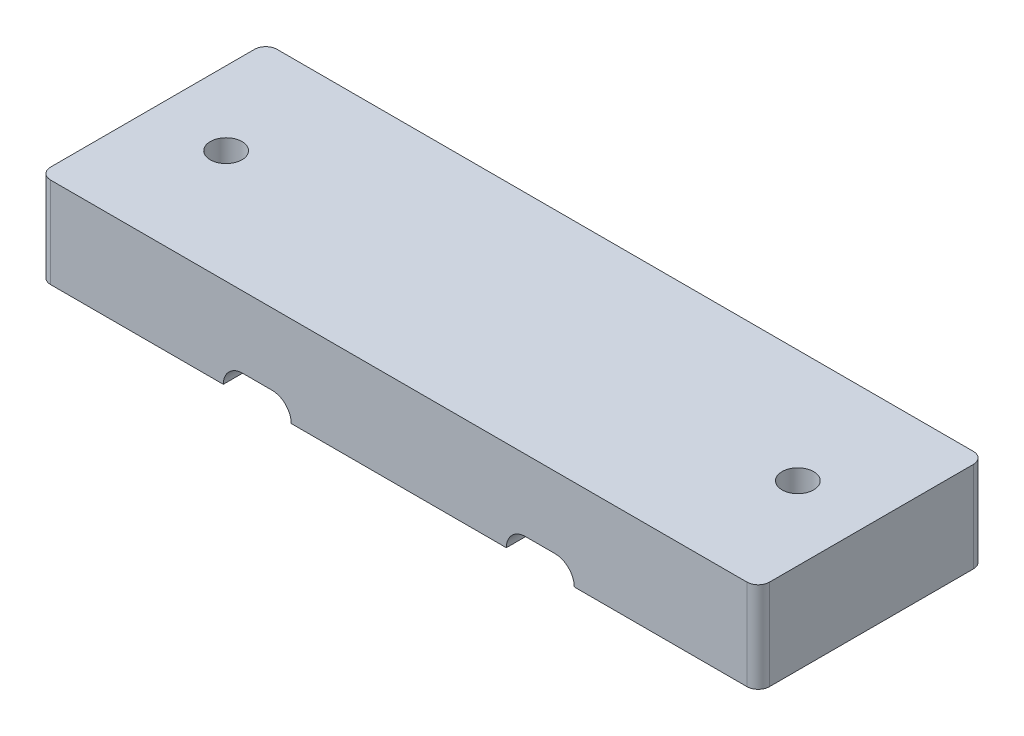
from build123d import *

# Parameters (mm, degrees)
SKETCH1_W            = 63.5
SKETCH1_H            = 20
SKETCH1_R            = 1.4
BASE_DEPTH           = 8
WIRE_GROOVES_DEPTH   = 39.833780398
F_1MM_EDGE_FILLETS_R = 1


with BuildPart() as part:
    # Sketch1 → Base (new body)
    with BuildSketch(Plane(origin=(0, 0, 0), x_dir=(1, 0, 0), z_dir=(0, 1, 0))):
        Rectangle(SKETCH1_W, SKETCH1_H)
        with Locations((-25.25, 0)):
            Circle(SKETCH1_R, mode=Mode.SUBTRACT)
        with Locations((25.25, 0)):
            Circle(SKETCH1_R, mode=Mode.SUBTRACT)
    extrude(amount=BASE_DEPTH)

    # Sketch2 → Wire Grooves (cut, through all)
    with BuildSketch(Plane(origin=(0, 10, -10), x_dir=(1, 0, 0), z_dir=(0, 0, -1))):
        with BuildLine():
            Line((-15.5, 10), (-9.5, 10))
            ThreePointArc((-9.5, 10), (-9.997918472, 8.797918472), (-11.2, 8.3))
            Line((-11.2, 8.3), (-13.8, 8.3))
            ThreePointArc((-13.8, 8.3), (-15.002081528, 8.797918472), (-15.5, 10))
        make_face()
        with BuildLine():
            Line((9.5, 10), (15.5, 10))
            ThreePointArc((15.5, 10), (15.002081528, 8.797918472), (13.8, 8.3))
            Line((13.8, 8.3), (11.2, 8.3))
            ThreePointArc((11.2, 8.3), (9.997918472, 8.797918472), (9.5, 10))
        make_face()
    extrude(amount=-WIRE_GROOVES_DEPTH, mode=Mode.SUBTRACT)

    # 1mm Edge Fillets
    f_1mm_edge_fillets_edges = [part.edges().sort_by_distance(p)[0] for p in [
        (-31.75, 4, -10),
        (31.75, 4, -10),
        (31.75, 4, 10),
        (-31.75, 4, 10),
    ]]
    fillet(f_1mm_edge_fillets_edges, radius=F_1MM_EDGE_FILLETS_R)


solid = part.part
